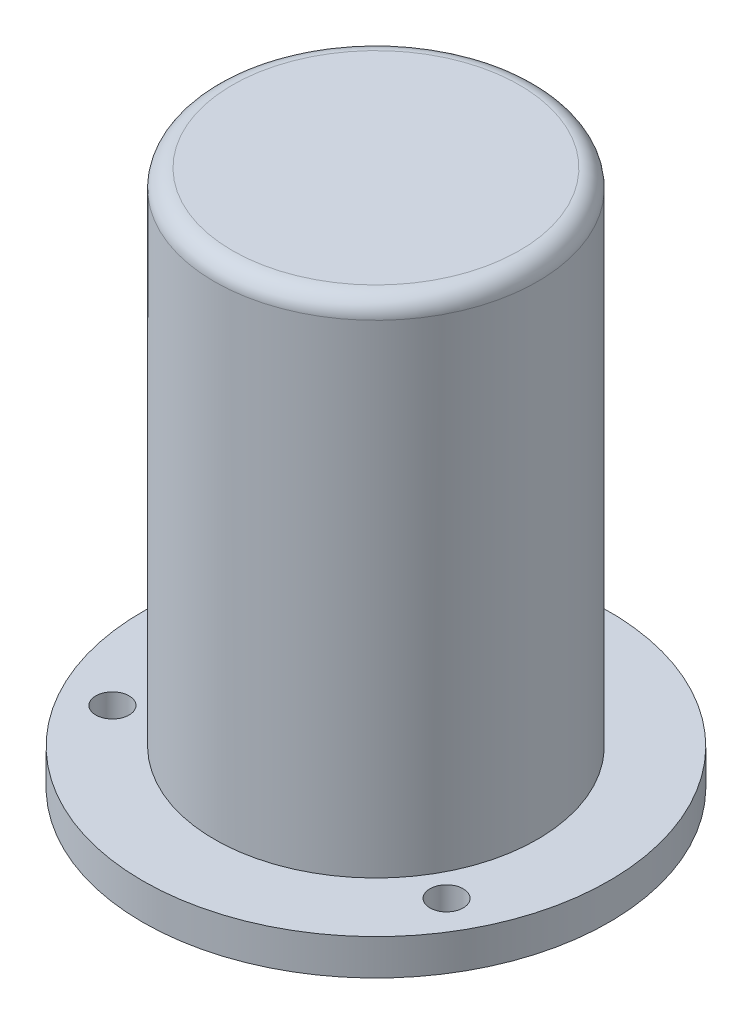
from build123d import *

# Parameters (mm, degrees)
SKETCH1_R           = 20.6375
BOSS_EXTRUDE1_DEPTH = 3.175
BOSS_EXTRUDE2_START = -3.175
SKETCH2_R           = 14.2875
BOSS_EXTRUDE2_DEPTH = 47.498
SKETCH3_R           = 1.4732
CUT_EXTRUDE1_DEPTH  = 54.069210862
SKETCH4_R           = 13.6144
CUT_EXTRUDE2_DEPTH  = 46.8122
FILLET1_R           = 1.5875


with BuildPart() as part:
    # Sketch1 → Boss-Extrude1 (new body)
    with BuildSketch(Plane(origin=(0, 0, 0), x_dir=(1, 0, 0), z_dir=(0, 1, 0))):
        with Locations(Location((0, 0, 0), (0, 0, 270))):
            Circle(SKETCH1_R)
    extrude(amount=BOSS_EXTRUDE1_DEPTH)

    # Sketch2 → Boss-Extrude2 (add)
    with BuildSketch(Plane(origin=(0, 3.175, 0), x_dir=(1, 0, 0), z_dir=(0, 1, 0)).offset(BOSS_EXTRUDE2_START)):
        with Locations(Location((0, 0, 0), (0, 0, 90))):
            Circle(SKETCH2_R)
    extrude(amount=BOSS_EXTRUDE2_DEPTH)

    # Sketch3 → Cut-Extrude1 (cut, through all)
    with BuildSketch(Plane(origin=(0, 3.175, 0), x_dir=(1, 0, 0), z_dir=(0, 1, 0))):
        with Locations(Location((0, 17.0688, 0), (0, 0, 270))):
            Circle(SKETCH3_R)
        with Locations(Location((14.782014412, -8.5344, 0), (0, 0, 270))):
            Circle(SKETCH3_R)
        with Locations(Location((-14.782014412, -8.5344, 0), (0, 0, 270))):
            Circle(SKETCH3_R)
    extrude(amount=-CUT_EXTRUDE1_DEPTH, mode=Mode.SUBTRACT)

    # Sketch4 → Cut-Extrude2 (cut)
    with BuildSketch(Plane.XZ):
        with Locations(Location((0, 0, 0), (0, 0, 270))):
            Circle(SKETCH4_R)
    extrude(amount=-CUT_EXTRUDE2_DEPTH, mode=Mode.SUBTRACT)

    # Fillet1
    fillet1_edges = [part.edges().sort_by_distance(p)[0] for p in [
        (0, 47.498, 14.2875),
    ]]
    fillet(fillet1_edges, radius=FILLET1_R)


solid = part.part
